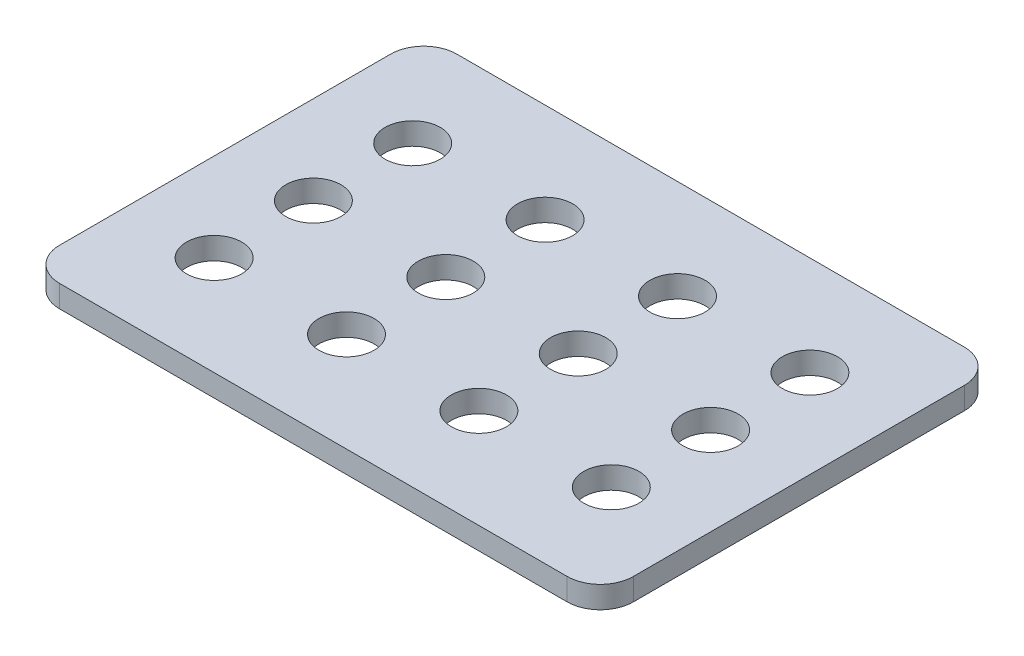
from build123d import *

# Parameters (mm, degrees)
SKETCH1_R           = 12.5
BOSS_EXTRUDE1_DEPTH = 10


with BuildPart() as part:
    # Sketch1 → Boss-Extrude1 (new body)
    with BuildSketch(Plane(origin=(0, 0, 0), x_dir=(1, 0, 0), z_dir=(0, 1, 0))):
        with BuildLine():
            Line((15, 0), (245, 0))
            ThreePointArc((245, 0), (255.606601718, 4.393398282), (260, 15))
            Line((260, 15), (260, 165))
            ThreePointArc((260, 165), (255.606601718, 175.606601718), (245, 180))
            Line((245, 180), (15, 180))
            ThreePointArc((15, 180), (4.393398282, 175.606601718), (0, 165))
            Line((0, 165), (0, 15))
            ThreePointArc((0, 15), (4.393398282, 4.393398282), (15, 0))
        make_face()
        with Locations(Location((40, 45, 0), (0, 0, 270))):
            Circle(SKETCH1_R, mode=Mode.SUBTRACT)
        with Locations(Location((40, 90, 0), (0, 0, 270))):
            Circle(SKETCH1_R, mode=Mode.SUBTRACT)
        with Locations(Location((40, 135, 0), (0, 0, 270))):
            Circle(SKETCH1_R, mode=Mode.SUBTRACT)
        with Locations(Location((100, 45, 0), (0, 0, 270))):
            Circle(SKETCH1_R, mode=Mode.SUBTRACT)
        with Locations(Location((100, 90, 0), (0, 0, 270))):
            Circle(SKETCH1_R, mode=Mode.SUBTRACT)
        with Locations(Location((100, 135, 0), (0, 0, 270))):
            Circle(SKETCH1_R, mode=Mode.SUBTRACT)
        with Locations(Location((160, 45, 0), (0, 0, 270))):
            Circle(SKETCH1_R, mode=Mode.SUBTRACT)
        with Locations(Location((160, 90, 0), (0, 0, 270))):
            Circle(SKETCH1_R, mode=Mode.SUBTRACT)
        with Locations(Location((160, 135, 0), (0, 0, 270))):
            Circle(SKETCH1_R, mode=Mode.SUBTRACT)
        with Locations(Location((220, 45, 0), (0, 0, 270))):
            Circle(SKETCH1_R, mode=Mode.SUBTRACT)
        with Locations(Location((220, 90, 0), (0, 0, 270))):
            Circle(SKETCH1_R, mode=Mode.SUBTRACT)
        with Locations(Location((220, 135, 0), (0, 0, 270))):
            Circle(SKETCH1_R, mode=Mode.SUBTRACT)
    extrude(amount=-BOSS_EXTRUDE1_DEPTH)


solid = part.part
